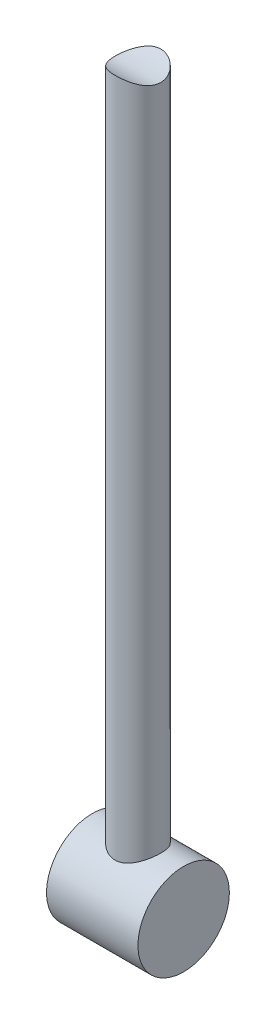
from build123d import *

# Parameters (mm, degrees)
CROQUIS1_R                 = 50
SALIENTE_EXTRUIR1_DEPTH    = 50
CROQUIS2_R                 = 25
SALIENTE_EXTRUIR2_DEPTH    = 800
CORTAR_EXTRUIR1_DEPTH      = 804.118920323
CORTAR_EXTRUIR1_DEPTH_BACK = 804.118920323
CROQUIS3_R                 = 50


with BuildPart() as part:
    # Croquis1 → Saliente-Extruir1 (new, symmetric)
    with BuildSketch(Plane(origin=(0, 0, 0), x_dir=(0, 0, -1), z_dir=(1, 0, 0))):
        Circle(CROQUIS1_R)
    extrude(amount=SALIENTE_EXTRUIR1_DEPTH, both=True)

    # Croquis2 → Saliente-Extruir2 (add)
    with BuildSketch(Plane(origin=(0, 0, 0), x_dir=(1, 0, 0), z_dir=(0, 1, 0))):
        with Locations(Location((0, 0, 0), (0, 0, 90))):
            Circle(CROQUIS2_R)
    extrude(amount=SALIENTE_EXTRUIR2_DEPTH)

    # Croquis3 → Cortar-Extruir1 (cut, two sides: drawn at the far end of the back side and taken through both)
    with BuildSketch(Plane(origin=(0, 0, 0), x_dir=(0, 0, -1), z_dir=(1, 0, 0)).offset(-CORTAR_EXTRUIR1_DEPTH_BACK)):
        with Locations((0, 830)):
            Circle(CROQUIS3_R)
    extrude(amount=CORTAR_EXTRUIR1_DEPTH + CORTAR_EXTRUIR1_DEPTH_BACK, mode=Mode.SUBTRACT)


solid = part.part
